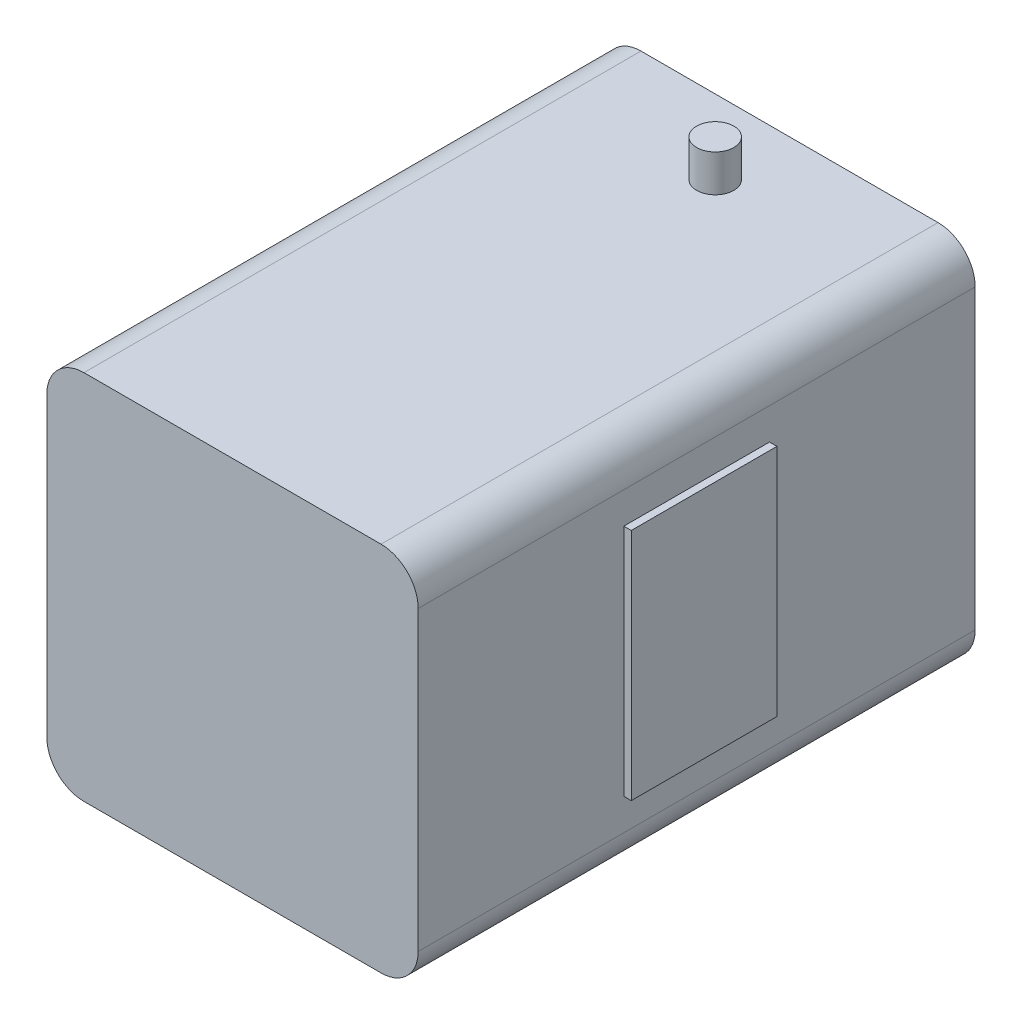
from build123d import *

# Parameters (mm, degrees)
SKETCH1_W                = 100
SKETCH1_H                = 100
BOSS_EXTRUDE1_DEPTH      = 150
FILLET1_R                = 10
SKETCH2_W                = 39.23098356
SKETCH2_H                = 63.007337234
BOSS_EXTRUDE2_DEPTH      = 2
BOSS_EXTRUDE3_DEPTH      = 10
BOSS_EXTRUDE3_DEPTH_BACK = 110
SKETCH3_R                = 5


with BuildPart() as part:
    # Sketch1 → Boss-Extrude1 (new body)
    with BuildSketch(Plane.XY):
        Rectangle(SKETCH1_W, SKETCH1_H)
    extrude(amount=BOSS_EXTRUDE1_DEPTH)

    # Fillet1
    fillet1_edges = [part.edges().sort_by_distance(p)[0] for p in [
        (50, -50, 75),
        (-50, -50, 75),
        (-50, 50, 75),
        (50, 50, 75),
    ]]
    fillet(fillet1_edges, radius=FILLET1_R)

    # Sketch2 → Boss-Extrude2 (add)
    with BuildSketch(Plane(origin=(50, 0, 0), x_dir=(0, 0, -1), z_dir=(1, 0, 0))):
        with Locations((-75, 0)):
            Rectangle(SKETCH2_W, SKETCH2_H)
    extrude(amount=BOSS_EXTRUDE2_DEPTH)

    # Sketch3 → Boss-Extrude3 (add, two sides: drawn at the far end of the back side and taken through both)
    with BuildSketch(Plane.XZ.offset(50).offset(-BOSS_EXTRUDE3_DEPTH_BACK)):
        with Locations(Location((0, 20, 0), (0, 0, 270))):
            Circle(SKETCH3_R)
    extrude(amount=BOSS_EXTRUDE3_DEPTH + BOSS_EXTRUDE3_DEPTH_BACK)


solid = part.part
